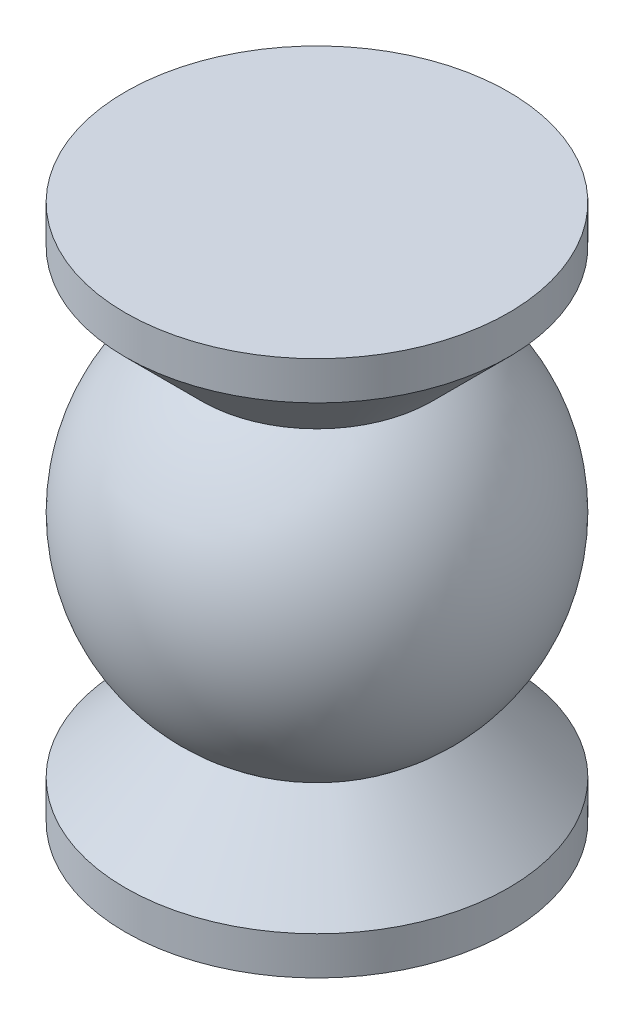
from build123d import *


with BuildPart() as part:
    # 草图1 → 旋转1 (revolve)
    with BuildSketch(Plane.XY, mode=Mode.PRIVATE) as revolve_1_sk:
        with BuildLine():
            Line((0, 35), (25, 35))
            Line((25, 35), (25, 30))
            Line((25, 30), (15, 20))
            ThreePointArc((15, 20), (25, 0), (15, -20))
            Line((15, -20), (25, -30))
            Line((25, -30), (25, -35))
            Line((25, -35), (0, -35))
            Line((0, -35), (0, 35))
        make_face()
    revolve(revolve_1_sk.sketch.rotate(Axis((0, 52.374299034, 0), (0, -1, 0)), 90), axis=Axis((0, 52.374299034, 0), (0, -1, 0)))


solid = part.part
